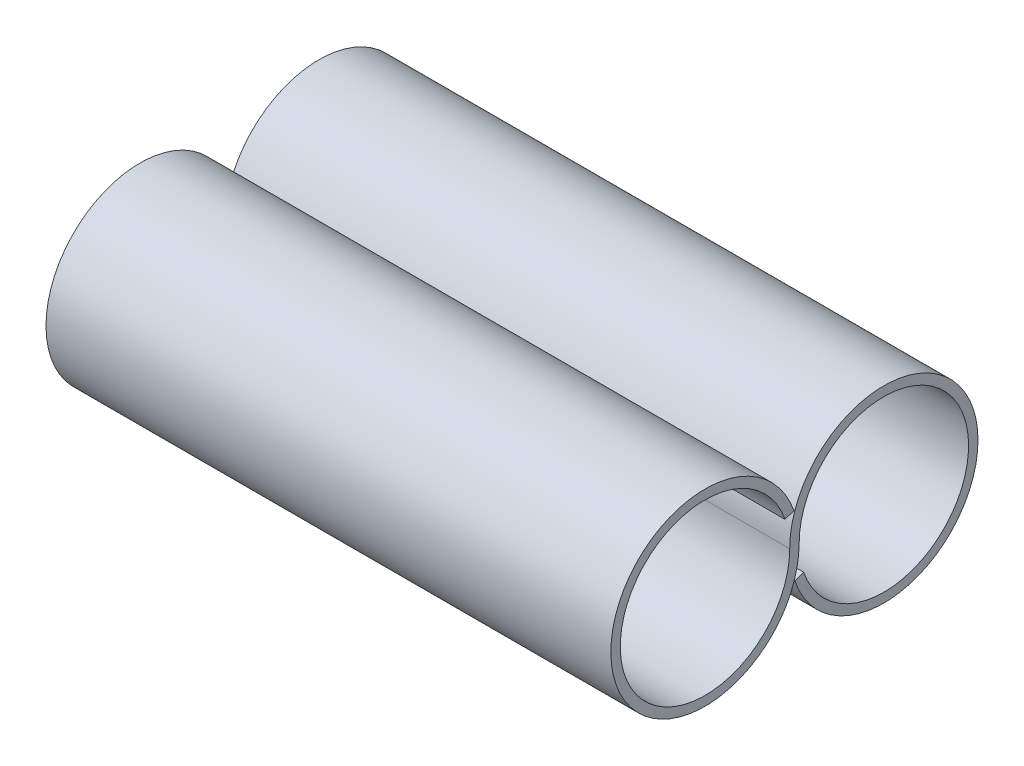
from build123d import *

# Parameters (mm, degrees)
BOSS_EXTRUDE2_DEPTH = 60


with BuildPart() as part:
    # Sketch2 → Boss-Extrude2 (new body)
    with BuildSketch(Plane(origin=(0, 0, 0), x_dir=(0, 0, -1), z_dir=(1, 0, 0))):
        with BuildLine():
            Line((0.739342205, 3.67378114), (-0.205280141, 3.345621692))
            ThreePointArc((-0.205280141, 3.345621692), (-17.581406877, -1.105409742), (0.293118745, 0.39218666))
            ThreePointArc((0.293118745, 0.39218666), (20.159745268, 2.019970755), (0.823054957, -2.819960885))
            Line((0.823054957, -2.819960885), (1.770061335, -2.49874613))
            ThreePointArc((1.770061335, -2.49874613), (19.173082615, 1.857192345), (1.293118745, 0.39218666))
            ThreePointArc((1.293118745, 0.39218666), (-18.56746528, -1.271809343), (0.739342205, 3.67378114))
        make_face()
    extrude(amount=BOSS_EXTRUDE2_DEPTH)


solid = part.part
